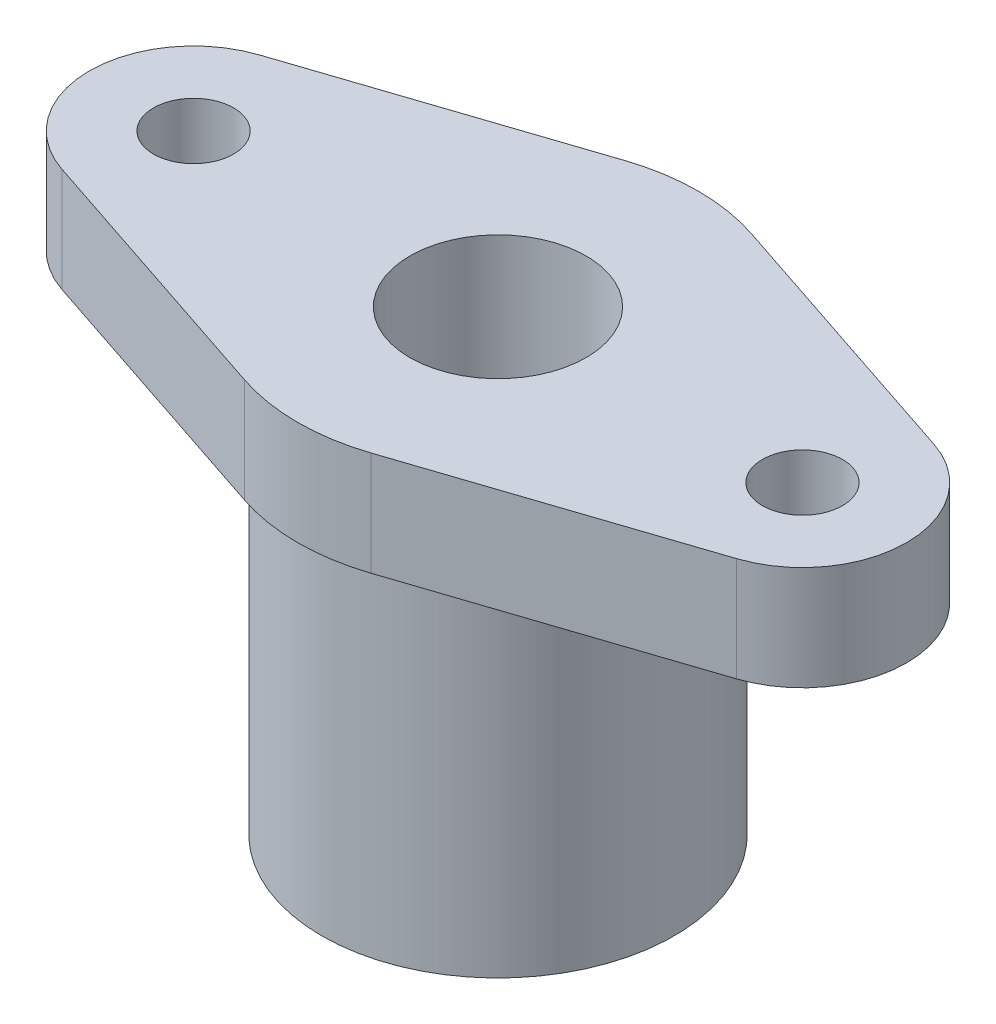
from build123d import *

# Parameters (mm, degrees)
SKETCH1_R           = 5
BOSS_EXTRUDE1_DEPTH = 13
SKETCH2_R           = 22
BOSS_EXTRUDE2_DEPTH = 44


with BuildPart() as part:
    # Sketch1 → Boss-Extrude1 (new body)
    with BuildSketch(Plane(origin=(0, 0, 0), x_dir=(1, 0, 0), z_dir=(0, 1, 0))):
        with BuildLine():
            Line((-42.105263158, 12.334780679), (-7.894736842, 23.720732075))
            ThreePointArc((-7.894736842, 23.720732075), (0, 25), (7.894736842, 23.720732075))
            Line((7.894736842, 23.720732075), (42.105263158, 12.334780679))
            ThreePointArc((42.105263158, 12.334780679), (51, 0), (42.105263158, -12.334780679))
            Line((42.105263158, -12.334780679), (7.894736842, -23.720732075))
            ThreePointArc((7.894736842, -23.720732075), (0, -25), (-7.894736842, -23.720732075))
            Line((-7.894736842, -23.720732075), (-42.105263158, -12.334780679))
            ThreePointArc((-42.105263158, -12.334780679), (-51, 0), (-42.105263158, 12.334780679))
        make_face()
        with Locations(Location((38, 0, 0), (0, 0, 270))):
            Circle(SKETCH1_R, mode=Mode.SUBTRACT)
        with Locations(Location((-38, 0, 0), (0, 0, 270))):
            Circle(SKETCH1_R, mode=Mode.SUBTRACT)
    extrude(amount=-BOSS_EXTRUDE1_DEPTH)

    # Sketch2 → Boss-Extrude2 (add)
    with BuildSketch(Plane.XZ.offset(13)):
        with Locations(Location((0, 0, 0), (0, 0, 90))):
            Circle(SKETCH2_R)
    extrude(amount=BOSS_EXTRUDE2_DEPTH)

    # Sketch3 → Cut-Revolve2 (revolve, cut)
    with BuildSketch(Plane.XY, mode=Mode.PRIVATE) as cut_revolve2_sk:
        Polygon((0, 0), (-11, 0), (-11, -50.649147039), (-22, -57), (0, -57), align=None)
    revolve(cut_revolve2_sk.sketch.rotate(Axis((0, 0, 0), (0, -1, 0)), 270), axis=Axis((0, 0, 0), (0, -1, 0)), mode=Mode.SUBTRACT)


solid = part.part
